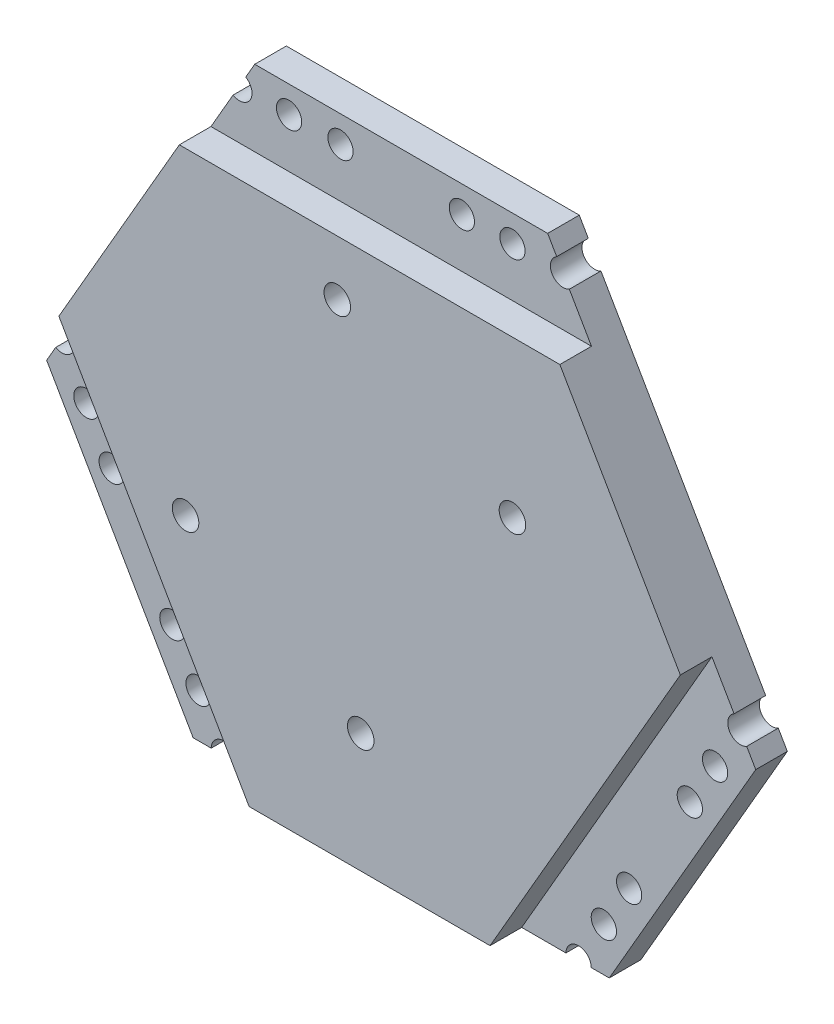
from build123d import *

# Parameters (mm, degrees)
EXTRUDE_4_DEPTH      = 10
SKETCH_2_R           = 2.1
CUT_EXTRUDE_1_DEPTH  = 104.128172694
SKETCH_4_W           = 60.2
SKETCH_4_H           = 12
CUT_EXTRUDE_2_DEPTH  = 5
CUT_EXTRUDE_9_DEPTH  = 125.764203881
EXTRUDE_5_DEPTH      = 3
CUT_EXTRUDE_10_DEPTH = 6
FILLET_1_R           = 2
FILLET_2_R           = 2
SKETCH_10_R          = 0.65
CUT_EXTRUDE_11_DEPTH = 6
CUT_EXTRUDE_12_DEPTH = 127.561979888
CUT_EXTRUDE_13_DEPTH = 124.620047186


with BuildPart() as part:
    # 草圖1 → 填料-伸長4 (new body)
    with BuildSketch(Plane.XY):
        Polygon((49.802669845, 25.924393386), (-10.397330155, 25.924393386), (-29.457330155, -7.088495007), (0.642669845, -59.223224314), (38.762669845, -59.223224314), (68.862669845, -7.088495007), align=None)
        with BuildLine():
            Line((-0.037670798, 33.71862202), (-3.897330155, 33.71862202))
            ThreePointArc((-3.897330155, 33.71862202), (-4.897330155, 31.986571212), (-6.897330155, 31.986571212))
            Line((-6.897330155, 31.986571212), (-10.397330155, 25.924393386))
            Line((-10.397330155, 25.924393386), (49.802669845, 25.924393386))
            Line((49.802669845, 25.924393386), (46.302669845, 31.986571212))
            ThreePointArc((46.302669845, 31.986571212), (44.302669845, 31.986571212), (43.302669845, 33.71862202))
            Line((43.302669845, 33.71862202), (39.302669845, 33.71862202))
            ThreePointArc((39.302669845, 33.71862202), (37.302669845, 31.71862202), (35.302669845, 33.71862202))
            Line((35.302669845, 33.71862202), (31.302669845, 33.71862202))
            ThreePointArc((31.302669845, 33.71862202), (29.302669845, 31.71862202), (27.302669845, 33.71862202))
            Line((27.302669845, 33.71862202), (12.102669845, 33.71862202))
            ThreePointArc((12.102669845, 33.71862202), (10.102669845, 31.71862202), (8.102669845, 33.71862202))
            Line((8.102669845, 33.71862202), (3.962329202, 33.71862202))
            ThreePointArc((3.962329202, 33.71862202), (1.962329202, 31.71862202), (-0.037670798, 33.71862202))
        make_face()
        with BuildLine():
            ThreePointArc((-6.897330155, 31.986571212), (-6.897330155, 35.450672827), (-3.897330155, 33.71862202))
            Line((-3.897330155, 33.71862202), (-0.037670798, 33.71862202))
            ThreePointArc((-0.037670798, 33.71862202), (1.962329202, 35.71862202), (3.962329202, 33.71862202))
            Line((3.962329202, 33.71862202), (8.102669845, 33.71862202))
            ThreePointArc((8.102669845, 33.71862202), (10.102669845, 35.71862202), (12.102669845, 33.71862202))
            Line((12.102669845, 33.71862202), (27.302669845, 33.71862202))
            ThreePointArc((27.302669845, 33.71862202), (29.302669845, 35.71862202), (31.302669845, 33.71862202))
            Line((31.302669845, 33.71862202), (35.302669845, 33.71862202))
            ThreePointArc((35.302669845, 33.71862202), (37.302669845, 35.71862202), (39.302669845, 33.71862202))
            Line((39.302669845, 33.71862202), (43.302669845, 33.71862202))
            ThreePointArc((43.302669845, 33.71862202), (45.302669845, 35.71862202), (47.302669845, 33.71862202))
            ThreePointArc((47.302669845, 33.71862202), (47.034720652, 32.71862202), (46.302669845, 31.986571212))
            Line((46.302669845, 31.986571212), (49.802669845, 25.924393386))
            Line((49.802669845, 25.924393386), (49.802669845, 37.924393386))
            Line((49.802669845, 37.924393386), (-10.397330155, 37.924393386))
            Line((-10.397330155, 37.924393386), (-10.397330155, 25.924393386))
            Line((-10.397330155, 25.924393386), (-6.897330155, 31.986571212))
        make_face()
        with BuildLine():
            Line((-32.957330155, -13.150672833), (-29.457330155, -7.088495007))
            Line((-29.457330155, -7.088495007), (-39.849635001, -13.088495007))
            Line((-39.849635001, -13.088495007), (-9.749635001, -65.223224314))
            Line((-9.749635001, -65.223224314), (0.642669845, -59.223224314))
            Line((0.642669845, -59.223224314), (-6.357330155, -59.223224314))
            ThreePointArc((-6.357330155, -59.223224314), (-9.357330155, -60.955275122), (-9.357330155, -57.491173507))
            Line((-9.357330155, -57.491173507), (-11.357330155, -54.027071892))
            ThreePointArc((-11.357330155, -54.027071892), (-14.089380963, -53.295021084), (-13.357330155, -50.562970277))
            Line((-13.357330155, -50.562970277), (-15.394263476, -47.034898273))
            ThreePointArc((-15.394263476, -47.034898273), (-18.229721605, -46.366817854), (-17.390567155, -43.577198874))
            Line((-17.390567155, -43.577198874), (-24.994263476, -30.40721052))
            ThreePointArc((-24.994263476, -30.40721052), (-27.829721605, -29.739130101), (-26.990567155, -26.949511121))
            Line((-26.990567155, -26.949511121), (-28.994263476, -23.47900729))
            ThreePointArc((-28.994263476, -23.47900729), (-31.829721605, -22.810926871), (-30.990567155, -20.021307891))
            Line((-30.990567155, -20.021307891), (-32.957330155, -16.614774448))
            ThreePointArc((-32.957330155, -16.614774448), (-35.957330155, -14.882723641), (-32.957330155, -13.150672833))
        make_face()
        with BuildLine():
            Line((0.642669845, -59.223224314), (-29.457330155, -7.088495007))
            Line((-29.457330155, -7.088495007), (-32.957330155, -13.150672833))
            ThreePointArc((-32.957330155, -13.150672833), (-32.225279348, -13.882723641), (-31.957330155, -14.882723641))
            ThreePointArc((-31.957330155, -14.882723641), (-32.225279348, -15.882723641), (-32.957330155, -16.614774448))
            Line((-32.957330155, -16.614774448), (-30.990567155, -20.021307891))
            ThreePointArc((-30.990567155, -20.021307891), (-29.045480871, -20.110075214), (-28.097670798, -21.810926871))
            ThreePointArc((-28.097670798, -21.810926871), (-28.336021763, -22.75781265), (-28.994263476, -23.47900729))
            Line((-28.994263476, -23.47900729), (-26.990567155, -26.949511121))
            ThreePointArc((-26.990567155, -26.949511121), (-25.045480871, -27.038278445), (-24.097670798, -28.739130101))
            ThreePointArc((-24.097670798, -28.739130101), (-24.336021763, -29.68601588), (-24.994263476, -30.40721052))
            Line((-24.994263476, -30.40721052), (-17.390567155, -43.577198874))
            ThreePointArc((-17.390567155, -43.577198874), (-15.445480871, -43.665966197), (-14.497670798, -45.366817854))
            ThreePointArc((-14.497670798, -45.366817854), (-14.736021763, -46.313703633), (-15.394263476, -47.034898273))
            Line((-15.394263476, -47.034898273), (-13.357330155, -50.562970277))
            ThreePointArc((-13.357330155, -50.562970277), (-11.357330155, -50.562970277), (-10.357330155, -52.295021084))
            ThreePointArc((-10.357330155, -52.295021084), (-10.625279348, -53.295021084), (-11.357330155, -54.027071892))
            Line((-11.357330155, -54.027071892), (-9.357330155, -57.491173507))
            ThreePointArc((-9.357330155, -57.491173507), (-7.357330155, -57.491173507), (-6.357330155, -59.223224314))
            Line((-6.357330155, -59.223224314), (0.642669845, -59.223224314))
        make_face()
        with BuildLine():
            Line((79.25497469, -13.088495007), (68.862669845, -7.088495007))
            Line((68.862669845, -7.088495007), (72.362669845, -13.150672833))
            ThreePointArc((72.362669845, -13.150672833), (74.362669845, -13.150672833), (75.362669845, -14.882723641))
            ThreePointArc((75.362669845, -14.882723641), (74.362669845, -16.614774448), (72.362669845, -16.614774448))
            Line((72.362669845, -16.614774448), (70.362669845, -20.078876063))
            ThreePointArc((70.362669845, -20.078876063), (71.094720652, -20.810926871), (71.362669845, -21.810926871))
            ThreePointArc((71.362669845, -21.810926871), (70.362669845, -23.542977679), (68.362669845, -23.542977679))
            Line((68.362669845, -23.542977679), (66.362669845, -27.007079294))
            ThreePointArc((66.362669845, -27.007079294), (67.094720652, -27.739130101), (67.362669845, -28.739130101))
            ThreePointArc((67.362669845, -28.739130101), (66.362669845, -30.471180909), (64.362669845, -30.471180909))
            Line((64.362669845, -30.471180909), (56.762669845, -43.634767046))
            ThreePointArc((56.762669845, -43.634767046), (57.494720652, -44.366817854), (57.762669845, -45.366817854))
            ThreePointArc((57.762669845, -45.366817854), (56.762669845, -47.098868661), (54.762669845, -47.098868661))
            Line((54.762669845, -47.098868661), (52.762669845, -50.562970277))
            ThreePointArc((52.762669845, -50.562970277), (53.494720652, -51.295021084), (53.762669845, -52.295021084))
            ThreePointArc((53.762669845, -52.295021084), (52.762669845, -54.027071892), (50.762669845, -54.027071892))
            Line((50.762669845, -54.027071892), (48.762669845, -57.491173507))
            ThreePointArc((48.762669845, -57.491173507), (49.494720652, -58.223224314), (49.762669845, -59.223224314))
            ThreePointArc((49.762669845, -59.223224314), (47.762669845, -61.223224314), (45.762669845, -59.223224314))
            Line((45.762669845, -59.223224314), (38.762669845, -59.223224314))
            Line((38.762669845, -59.223224314), (49.15497469, -65.223224314))
            Line((49.15497469, -65.223224314), (79.25497469, -13.088495007))
        make_face()
        with BuildLine():
            Line((72.362669845, -13.150672833), (68.862669845, -7.088495007))
            Line((68.862669845, -7.088495007), (38.762669845, -59.223224314))
            Line((38.762669845, -59.223224314), (45.762669845, -59.223224314))
            ThreePointArc((45.762669845, -59.223224314), (46.762669845, -57.491173507), (48.762669845, -57.491173507))
            Line((48.762669845, -57.491173507), (50.762669845, -54.027071892))
            ThreePointArc((50.762669845, -54.027071892), (50.030619037, -51.295021084), (52.762669845, -50.562970277))
            Line((52.762669845, -50.562970277), (54.762669845, -47.098868661))
            ThreePointArc((54.762669845, -47.098868661), (54.030619037, -44.366817854), (56.762669845, -43.634767046))
            Line((56.762669845, -43.634767046), (64.362669845, -30.471180909))
            ThreePointArc((64.362669845, -30.471180909), (63.630619037, -27.739130101), (66.362669845, -27.007079294))
            Line((66.362669845, -27.007079294), (68.362669845, -23.542977679))
            ThreePointArc((68.362669845, -23.542977679), (67.630619037, -20.810926871), (70.362669845, -20.078876063))
            Line((70.362669845, -20.078876063), (72.362669845, -16.614774448))
            ThreePointArc((72.362669845, -16.614774448), (71.362669845, -14.882723641), (72.362669845, -13.150672833))
        make_face()
    extrude(amount=EXTRUDE_4_DEPTH)

    # 草圖2 → 除料-伸長1 (cut, through all)
    with BuildSketch(Plane(origin=(0, 0, 0), x_dir=(-1, 0, 0), z_dir=(0, 0, -1))):
        with Locations((9.410669657, -24.366660501)):
            Circle(SKETCH_2_R)
        with Locations((-14.589330343, 17.20255888)):
            Circle(SKETCH_2_R)
        with Locations((-42.302143264, 1.20255888)):
            Circle(SKETCH_2_R)
        with Locations((-18.302143264, -40.366660501)):
            Circle(SKETCH_2_R)
    extrude(amount=-CUT_EXTRUDE_1_DEPTH, mode=Mode.SUBTRACT)

    # 草圖4 → 除料-伸長2 (cut)
    with BuildSketch(Plane.XY.offset(10)):
        Polygon((38.762669845, -59.223224314), (49.15497469, -65.223224314), (79.264488572, -13.07201648), (68.872183727, -7.07201648), align=None)
        with Locations((19.702669845, 31.924393386)):
            Rectangle(SKETCH_4_W, SKETCH_4_H)
        Polygon((-29.457330155, -7.088495007), (-39.849635001, -13.088495007), (-9.472158735, -65.703827304), (0.92014611, -59.703827304), align=None)
    extrude(amount=-CUT_EXTRUDE_2_DEPTH, mode=Mode.SUBTRACT)

    # 草圖7 → 除料-伸長9 (cut, through all)
    with BuildSketch(Plane(origin=(-19.023589241, 10.983274369, 0), x_dir=(0, 0, 1), z_dir=(-0.8660254037844397, 0.499999999999998, 0))):
        Polygon((5, -20.867481828), (0, -20.867481828), (0, -53.816238545), (10, -53.816238545), (10, -20.867481828), align=None)
        Polygon((0, 46.26799966), (0, 17.252518172), (5, 17.252518172), (10, 17.252518172), (10, 46.26799966), align=None)
    extrude(amount=CUT_EXTRUDE_9_DEPTH, mode=Mode.SUBTRACT)

    # 草圖8 → 填料-伸長5 (add)
    with BuildSketch(Plane(origin=(0, 0, 0), x_dir=(-1, 0, 0), z_dir=(0, 0, -1))):
        Polygon((-20.704067053, -30.206406463), (1.812593446, -17.206406463), (-14.187406554, 10.506406458), (-36.704067053, -2.493593542), align=None)
    extrude(amount=EXTRUDE_5_DEPTH)

    # 草圖9 → 除料-伸長10 (cut)
    with BuildSketch(Plane(origin=(0, 0, -3), x_dir=(-1, 0, 0), z_dir=(0, 0, -1))):
        Polygon((-20.338041649, -28.84038106), (0.446568042, -16.84038106), (-14.553431958, 9.140381054), (-35.338041649, -2.859618946), align=None)
    extrude(amount=-CUT_EXTRUDE_10_DEPTH, mode=Mode.SUBTRACT)

    # 圓角1
    fillet_1_edges = [part.edges().sort_by_distance(p)[0] for p in [
        (20.338041649, -28.84038106, 0),
        (35.338041649, -2.859618946, 0),
        (14.553431958, 9.140381054, 0),
        (-0.446568042, -16.84038106, 0),
    ]]
    fillet(fillet_1_edges, radius=FILLET_1_R)

    # 圓角2
    fillet_2_edges = [part.edges().sort_by_distance(p)[0] for p in [
        (36.704067053, -2.493593542, -1.5),
        (20.704067053, -30.206406463, -1.5),
        (-1.812593446, -17.206406463, -1.5),
        (14.187406554, 10.506406458, -1.5),
    ]]
    fillet(fillet_2_edges, radius=FILLET_2_R)

    # 草圖10 → 除料-伸長11 (cut)
    with BuildSketch(Plane(origin=(0, 0, 3), x_dir=(-1, 0, 0), z_dir=(0, 0, -1))):
        with Locations((-29.190927332, -4.506733263)):
            Circle(SKETCH_10_R)
        with Locations((-16.200546275, 2.993266737)):
            Circle(SKETCH_10_R)
        with Locations((-5.700546275, -15.193266743)):
            Circle(SKETCH_10_R)
        with Locations((-18.690927332, -22.693266743)):
            Circle(SKETCH_10_R)
        Polygon((-3.303431958, -10.345190531), (-10.803431958, 2.645190525), (-31.587870903, -9.354710894), (-24.087870903, -22.345091951), align=None)
    extrude(amount=-CUT_EXTRUDE_11_DEPTH, mode=Mode.SUBTRACT)

    # 草圖12 → 除料-伸長12 (cut, through all)
    with BuildSketch(Plane(origin=(48.577594008, 28.046286977, 0), x_dir=(0, 0, -1), z_dir=(0.8660254037844362, 0.5000000000000041, 0))):
        Polygon((0, -70.38008838), (0, -40.570151673), (-5, -40.570151673), (-10, -40.570151673), (-10, -70.38008838), align=None)
        Polygon((-5, -2.450151673), (0, -2.450151673), (0, 27.877960609), (-10, 27.877960609), (-10, -2.450151673), align=None)
    extrude(amount=CUT_EXTRUDE_12_DEPTH, mode=Mode.SUBTRACT)

    # 草圖13 → 除料-伸長13 (cut, through all)
    with BuildSketch(Plane.XZ.offset(59.223224314)):
        Polygon((66.260162627, 10), (38.762669845, 10), (38.762669845, 5), (38.762669845, 0), (66.260162627, 0), align=None)
        Polygon((0.642669845, 5), (0.642669845, 10), (-25.338575987, 10), (-25.338575987, 0), (0.642669845, 0), align=None)
    extrude(amount=CUT_EXTRUDE_13_DEPTH, mode=Mode.SUBTRACT)


solid = part.part
